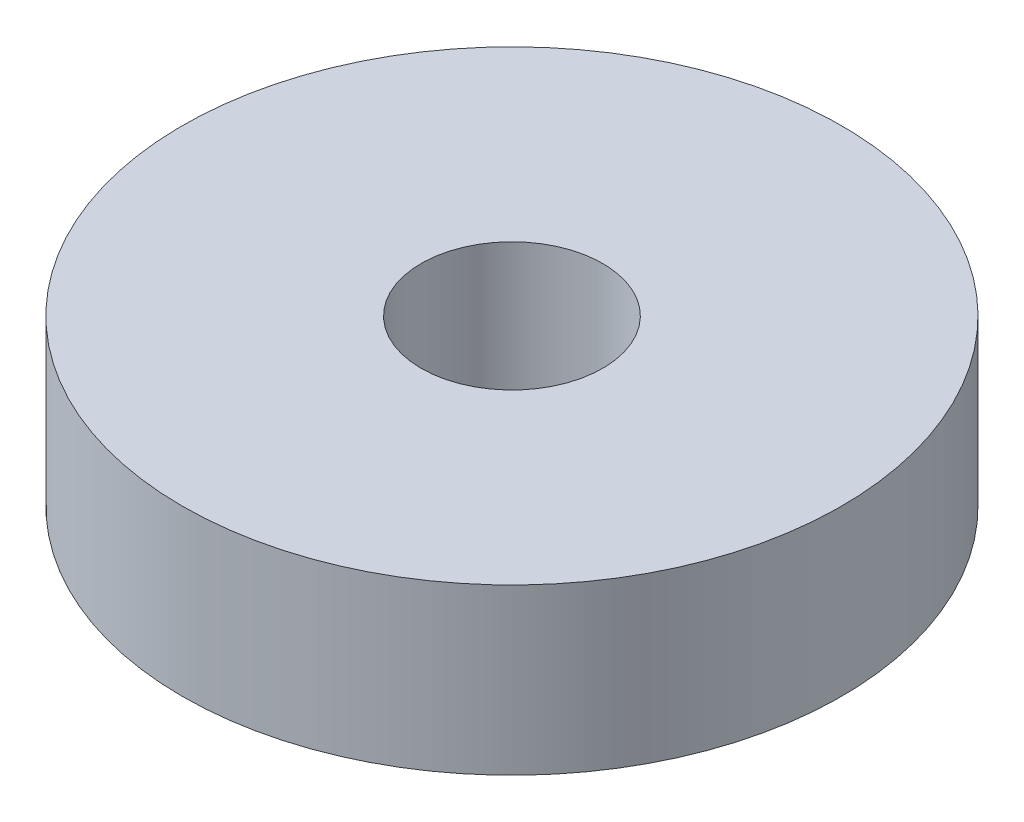
from build123d import *

# Parameters (mm, degrees)
SKETCH1_R           = 6.35
SKETCH1_R_2         = 1.75
BOSS_EXTRUDE1_DEPTH = 3.175


with BuildPart() as part:
    # Sketch1 → Boss-Extrude1 (new body)
    with BuildSketch(Plane(origin=(0, 0, 0), x_dir=(1, 0, 0), z_dir=(0, 1, 0))):
        with Locations(Location((0, 0, 0), (0, 0, 270))):
            Circle(SKETCH1_R)
        with Locations(Location((0, 0, 0), (0, 0, 270))):
            Circle(SKETCH1_R_2, mode=Mode.SUBTRACT)
    extrude(amount=BOSS_EXTRUDE1_DEPTH)


solid = part.part
